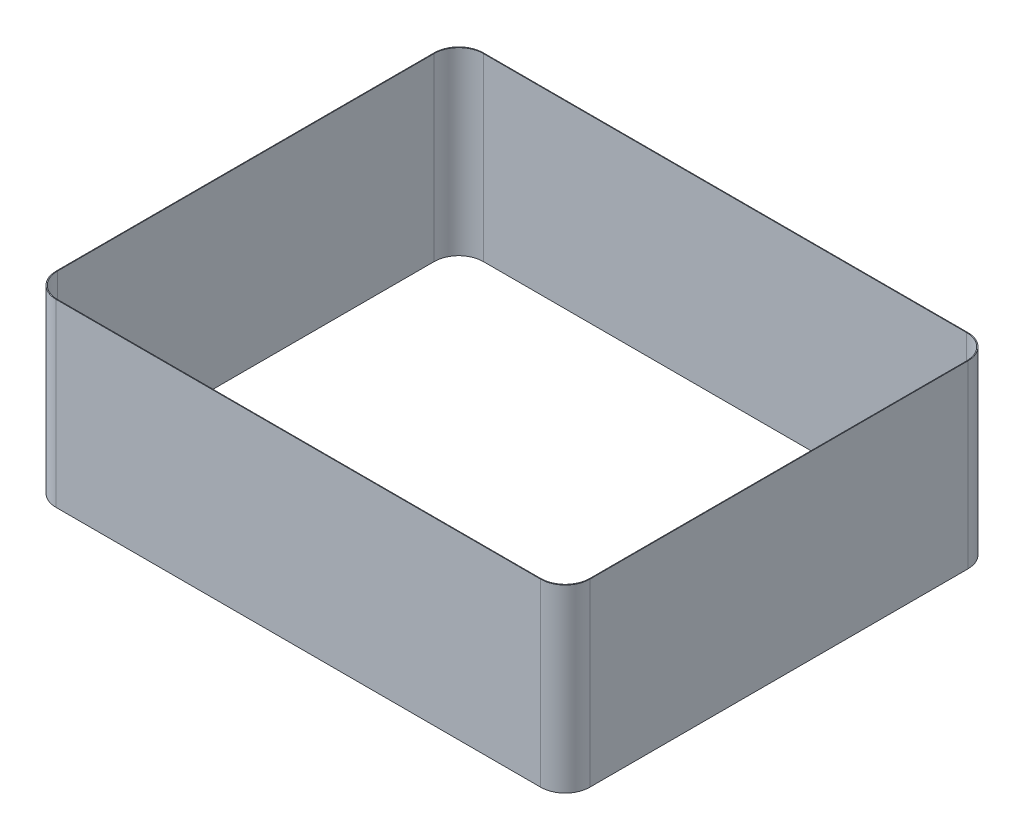
from build123d import *

# Parameters (mm, degrees)
BOSS_EXTRUDE1_DEPTH = 69.85


with BuildPart() as part:
    # Sketch1 → Boss-Extrude1 (new body)
    with BuildSketch(Plane(origin=(0, 0, 0), x_dir=(1, 0, 0), z_dir=(0, 1, 0))):
        with BuildLine():
            Line((-93.9165, -82.804), (93.9165, -82.804))
            ThreePointArc((93.9165, -82.804), (100.651692091, -80.014192091), (103.4415, -73.279))
            Line((103.4415, -73.279), (103.4415, 73.279))
            ThreePointArc((103.4415, 73.279), (100.651692091, 80.014192091), (93.9165, 82.804))
            Line((93.9165, 82.804), (-93.9165, 82.804))
            ThreePointArc((-93.9165, 82.804), (-100.651692091, 80.014192091), (-103.4415, 73.279))
            Line((-103.4415, 73.279), (-103.4415, -73.279))
            ThreePointArc((-103.4415, -73.279), (-100.651692091, -80.014192091), (-93.9165, -82.804))
        make_face()
        with BuildLine():
            Line((-93.6625, -82.55), (93.6625, -82.55))
            ThreePointArc((93.6625, -82.55), (100.397692091, -79.760192091), (103.1875, -73.025))
            Line((103.1875, -73.025), (103.1875, 73.025))
            ThreePointArc((103.1875, 73.025), (100.397692091, 79.760192091), (93.6625, 82.55))
            Line((93.6625, 82.55), (-93.6625, 82.55))
            ThreePointArc((-93.6625, 82.55), (-100.397692091, 79.760192091), (-103.1875, 73.025))
            Line((-103.1875, 73.025), (-103.1875, -73.025))
            ThreePointArc((-103.1875, -73.025), (-100.397692091, -79.760192091), (-93.6625, -82.55))
        make_face(mode=Mode.SUBTRACT)
    extrude(amount=BOSS_EXTRUDE1_DEPTH)


solid = part.part
